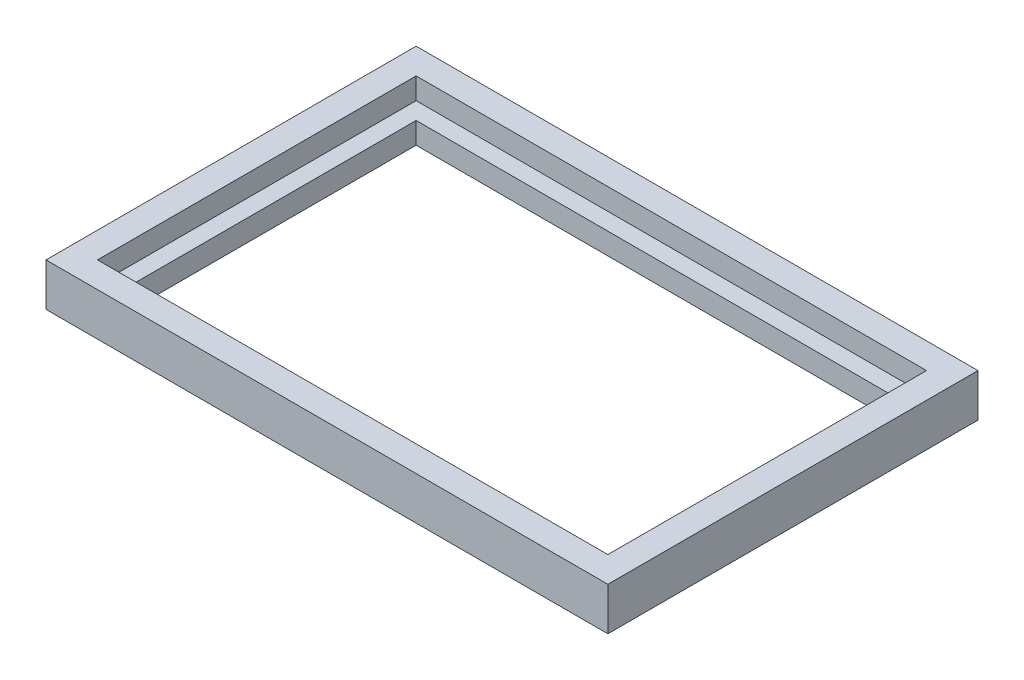
from build123d import *

# Parameters (mm, degrees)
BOSS_EXTRUDE1_DEPTH  = 5
SKETCH2_W            = 55.5
SKETCH2_H            = 33.15
CUT_EXTRUDE1_DEPTH   = 10
SKETCH3_W            = 59.5
SKETCH3_H            = 37.15
CUT_EXTRUDE2_DEPTH   = 2.5
SKETCH4_R            = 13.5
CUT_EXTRUDE3_DEPTH   = 2.5
SKETCH8_W            = 89
SKETCH8_H            = 36.5
CUT_EXTRUDE4_DEPTH   = 2.5
BOSS_EXTRUDE4_DEPTH  = 105
SKETCH10_OUTSIDE_W   = 200.486
SKETCH10_OUTSIDE_H   = 145.486
CUT_EXTRUDE5_DEPTH   = 105
SKETCH5_R            = 1.35
SKETCH5_R_2          = 0.95
SKETCH5_R_3          = 1.2
CUT_EXTRUDE6_DEPTH   = 3
SKETCH11_OUTSIDE_W   = 200.486
SKETCH11_OUTSIDE_H   = 145.486
SKETCH11_OUTSIDE_W_2 = 65.5
SKETCH11_OUTSIDE_H_2 = 43.15
CUT_EXTRUDE7_DEPTH   = 10


with BuildPart() as part:
    # Sketch1 → Boss-Extrude1 (new body)
    with BuildSketch(Plane(origin=(0, 0, 0), x_dir=(1, 0, 0), z_dir=(0, 1, 0))):
        with BuildLine():
            Line((40, -52.5), (-40, -52.5))
            ThreePointArc((-40, -52.5), (-68.284271247, -40.784271247), (-80, -12.5))
            Line((-80, -12.5), (-80, 12.5))
            ThreePointArc((-80, 12.5), (-68.284271247, 40.784271247), (-40, 52.5))
            Line((-40, 52.5), (40, 52.5))
            ThreePointArc((40, 52.5), (68.284271247, 40.784271247), (80, 12.5))
            Line((80, 12.5), (80, -12.5))
            ThreePointArc((80, -12.5), (68.284271247, -40.784271247), (40, -52.5))
        make_face()
    extrude(amount=BOSS_EXTRUDE1_DEPTH)

    # Sketch2 → Cut-Extrude1 (cut)
    with BuildSketch(Plane(origin=(0, 0, 0), x_dir=(-1, 0, 0), z_dir=(0, -1, 0))):
        with Locations((-6.459334532, -28.560438218)):
            Rectangle(SKETCH2_W, SKETCH2_H)
    extrude(amount=-CUT_EXTRUDE1_DEPTH, mode=Mode.SUBTRACT)

    # Sketch3 → Cut-Extrude2 (cut)
    with BuildSketch(Plane(origin=(0, 5, 0), x_dir=(1, 0, 0), z_dir=(0, 1, 0))):
        with Locations((6.459334532, -28.560438218)):
            Rectangle(SKETCH3_W, SKETCH3_H)
    extrude(amount=-CUT_EXTRUDE2_DEPTH, mode=Mode.SUBTRACT)

    # Sketch4 → Cut-Extrude3 (cut)
    with BuildSketch(Plane(origin=(0, 5, 0), x_dir=(1, 0, 0), z_dir=(0, 1, 0))):
        with Locations(Location((56.229894871, -16.5, 0), (0, 0, 270))):
            Circle(SKETCH4_R)
        with Locations(Location((-56.229894871, -16.5, 0), (0, 0, 90))):
            Circle(SKETCH4_R)
    extrude(amount=-CUT_EXTRUDE3_DEPTH, mode=Mode.SUBTRACT)

    # Sketch8 → Cut-Extrude4 (cut)
    with BuildSketch(Plane(origin=(0, 5, 0), x_dir=(1, 0, 0), z_dir=(0, 1, 0))):
        with Locations((0.079334532, 25.25)):
            Rectangle(SKETCH8_W, SKETCH8_H)
    extrude(amount=-CUT_EXTRUDE4_DEPTH, mode=Mode.SUBTRACT)

    # Sketch9 → Boss-Extrude4 (add)
    with BuildSketch(Plane.XY.offset(52.5)):
        with BuildLine():
            Line((-80, 0), (-40, 0))
            add(Edge.make_bspline(
                [(-80, 0), (-79.948023713, -3.673692429), (-77.584130198, -11.396455763), (-57.110208015, -20.509844228), (-48.902789398, -1.350898332), (-40, 0)],
                knots=[0, 0, 0, 0, 0.184459574, 0.474643138, 1, 1, 1, 1], degree=3))
        make_face()
        with BuildLine():
            Line((40, 0), (80, 0))
            add(Edge.make_bspline(
                [(80, 0), (79.948023713, -3.673692429), (77.584130198, -11.396455763), (57.110208015, -20.509844228), (48.902789398, -1.350898332), (40, 0)],
                knots=[0, 0, 0, 0, 0.184459574, 0.474643138, 1, 1, 1, 1], degree=3))
        make_face()
    extrude(amount=-BOSS_EXTRUDE4_DEPTH)

    # Sketch10 outside → Cut-Extrude5 (cut)
    with BuildSketch(Plane(origin=(0, 5, 0), x_dir=(1, 0, 0), z_dir=(0, 1, 0))):
        Rectangle(SKETCH10_OUTSIDE_W, SKETCH10_OUTSIDE_H)
        with BuildLine():
            Line((-80, 12.5), (-80, -12.5))
            ThreePointArc((-80, -12.5), (-68.284271247, -40.784271247), (-40, -52.5))
            Line((-40, -52.5), (40, -52.5))
            ThreePointArc((40, -52.5), (68.284271247, -40.784271247), (80, -12.5))
            Line((80, -12.5), (80, 12.5))
            ThreePointArc((80, 12.5), (68.284271247, 40.784271247), (40, 52.5))
            Line((40, 52.5), (-40, 52.5))
            ThreePointArc((-40, 52.5), (-68.284271247, 40.784271247), (-80, 12.5))
        make_face(mode=Mode.SUBTRACT)
    extrude(amount=-CUT_EXTRUDE5_DEPTH, mode=Mode.SUBTRACT)

    # Sketch5 → Cut-Extrude6 (cut)
    with BuildSketch(Plane(origin=(0, 5, 0), x_dir=(1, 0, 0), z_dir=(0, 1, 0))):
        with Locations(Location((66.054894871, -29.425, 0), (0, 0, 270))):
            Circle(SKETCH5_R)
        with Locations(Location((46.404894871, -29.425, 0), (0, 0, 270))):
            Circle(SKETCH5_R)
        with Locations(Location((66.054894871, -3.575, 0), (0, 0, 270))):
            Circle(SKETCH5_R)
        with Locations(Location((46.404894871, -3.575, 0), (0, 0, 270))):
            Circle(SKETCH5_R)
        with Locations(Location((-46.404894871, -29.425, 0), (0, 0, 90))):
            Circle(SKETCH5_R)
        with Locations(Location((-66.054894871, -29.425, 0), (0, 0, 90))):
            Circle(SKETCH5_R)
        with Locations(Location((-66.054894871, -3.575, 0), (0, 0, 90))):
            Circle(SKETCH5_R)
        with Locations(Location((-46.404894871, -3.575, 0), (0, 0, 90))):
            Circle(SKETCH5_R)
        with Locations(Location((46.579334532, 44.5, 0), (0, 0, 270))):
            Circle(SKETCH5_R_2)
        with Locations(Location((46.579334532, 5, 0), (0, 0, 270))):
            Circle(SKETCH5_R_2)
        with Locations(Location((-46.420665468, 5, 0), (0, 0, 270))):
            Circle(SKETCH5_R_2)
        with Locations(Location((-46.420665468, 44.5, 0), (0, 0, 270))):
            Circle(SKETCH5_R_2)
        with Locations(Location((-29.520665468, 0.75, 0), (0, 0, 270))):
            Circle(SKETCH5_R_3)
        with Locations(Location((-29.520665468, -44.95, 0), (0, 0, 270))):
            Circle(SKETCH5_R_3)
        with Locations(Location((36.179334532, 0.75, 0), (0, 0, 270))):
            Circle(SKETCH5_R_3)
    extrude(amount=-CUT_EXTRUDE6_DEPTH, mode=Mode.SUBTRACT)

    # Sketch11 outside → Cut-Extrude7 (cut)
    with BuildSketch(Plane(origin=(0, 5, 0), x_dir=(1, 0, 0), z_dir=(0, 1, 0))):
        Rectangle(SKETCH11_OUTSIDE_W, SKETCH11_OUTSIDE_H)
        with Locations((6.459334532, -28.560438218)):
            Rectangle(SKETCH11_OUTSIDE_W_2, SKETCH11_OUTSIDE_H_2, mode=Mode.SUBTRACT)
    extrude(amount=-CUT_EXTRUDE7_DEPTH, mode=Mode.SUBTRACT)


with BuildPart() as cut_extrude7_kept_piece:
    # of the separate pieces the step leaves, the one the design keeps (cut_extrude7_pieces_kept)
    add(part.part.solids().sort_by_distance((39.209334532, 0, 6.985438218))[0])


solid = cut_extrude7_kept_piece.part
